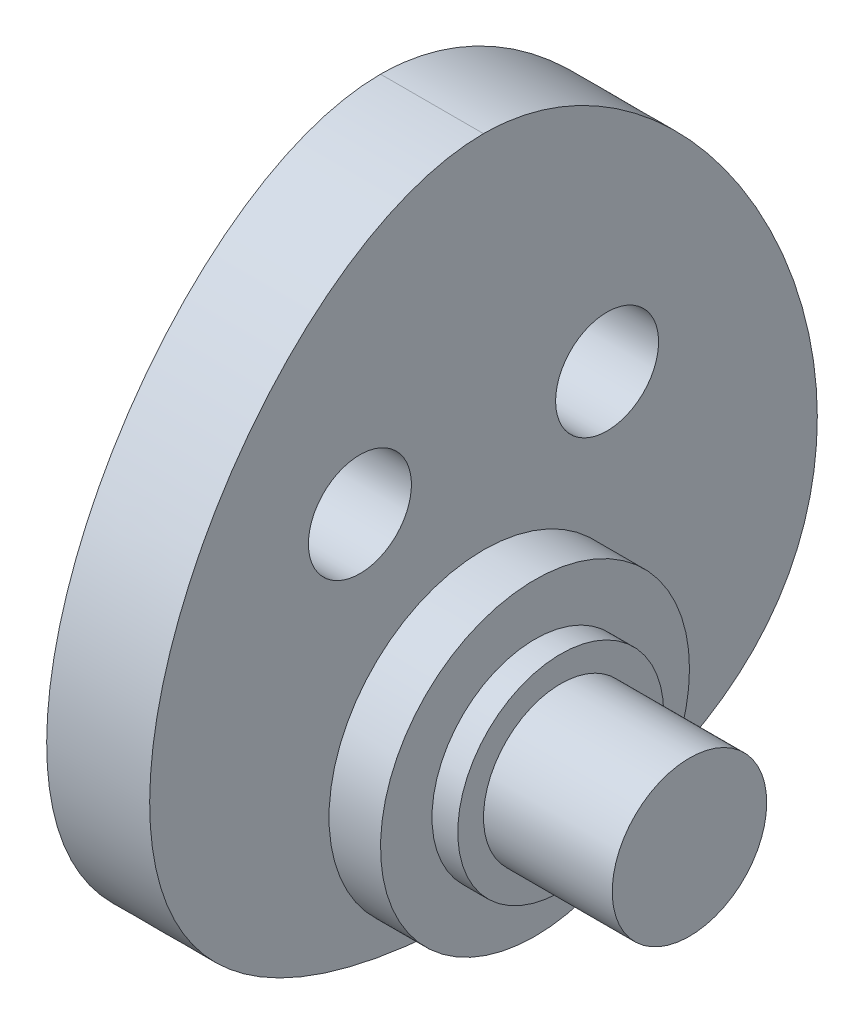
from build123d import *

# Parameters (mm, degrees)
SKETCH1_R           = 2.5
BOSS_EXTRUDE1_DEPTH = 2
SKETCH2_R           = 3
BOSS_EXTRUDE2_DEPTH = 4
CUT_EXTRUDE1_REACH  = 15.343
SKETCH3_R           = 1
CHAMFER1_SIZE       = 1
SKETCH4_OUTSIDE_W   = 18.83
SKETCH4_OUTSIDE_H   = 18.864
SKETCH4_OUTSIDE_R   = 1.5
CUT_EXTRUDE2_DEPTH  = 2.5
SKETCH5_OUTSIDE_W   = 18.83
SKETCH5_OUTSIDE_H   = 18.864
SKETCH5_OUTSIDE_R   = 2
CUT_EXTRUDE3_DEPTH  = 0.5


with BuildPart() as part:
    # Sketch1 → Boss-Extrude1 (new body)
    with BuildSketch(Plane(origin=(0, 0, 0), x_dir=(0, 0, -1), z_dir=(1, 0, 0))):
        with BuildLine():
            add(Edge.make_bspline(
                [(0, 10), (-5.575397586, 10), (-11.256765776, -3), (0, -3)],
                knots=[0, 0, 0, 0, 1, 1, 1, 1], degree=3))
            add(Edge.make_bspline(
                [(0, 10), (5.575397586, 10), (11.256765776, -3), (0, -3)],
                knots=[0, 0, 0, 0, 1, 1, 1, 1], degree=3))
        make_face()
        Circle(SKETCH1_R, mode=Mode.SUBTRACT)
    extrude(amount=BOSS_EXTRUDE1_DEPTH)

    # Sketch2 → Boss-Extrude2 (add)
    with BuildSketch(Plane(origin=(2, 0, 0), x_dir=(0, 0, -1), z_dir=(1, 0, 0))):
        with Locations(Location((0, 0, 0), (0, 0, 270))):
            Circle(SKETCH2_R)
    extrude(amount=BOSS_EXTRUDE2_DEPTH)

    # Sketch3 → Cut-Extrude1 (cut, up to next)
    with BuildSketch(Plane.ZY, mode=Mode.PRIVATE) as cut_extrude1_sk1:
        with Locations((-2.4, 4.8)):
            Circle(SKETCH3_R)
    cut_extrude1_tool1 = extrude(cut_extrude1_sk1.sketch, amount=-CUT_EXTRUDE1_REACH, mode=Mode.PRIVATE) & part.part
    # Sketch3 → Cut-Extrude1 (cut, up to next)
    with BuildSketch(Plane.ZY, mode=Mode.PRIVATE) as cut_extrude1_sk2:
        with Locations((2.4, 4.8)):
            Circle(SKETCH3_R)
    cut_extrude1_tool2 = extrude(cut_extrude1_sk2.sketch, amount=-CUT_EXTRUDE1_REACH, mode=Mode.PRIVATE) & part.part
    add(cut_extrude1_tool1.solids().sort_by_distance((0, 4.8, -2.4))[0], mode=Mode.SUBTRACT)
    add(cut_extrude1_tool2.solids().sort_by_distance((0, 4.8, 2.4))[0], mode=Mode.SUBTRACT)

    # Chamfer1
    chamfer1_edges = [part.edges().sort_by_distance(p)[0] for p in [
        (2, 0, 2.5),
    ]]
    chamfer(chamfer1_edges, length=CHAMFER1_SIZE)

    # Sketch4 outside → Cut-Extrude2 (cut)
    with BuildSketch(Plane(origin=(6, 0, 0), x_dir=(0, 0, -1), z_dir=(1, 0, 0))):
        with Locations((0, 3.5)):
            Rectangle(SKETCH4_OUTSIDE_W, SKETCH4_OUTSIDE_H)
        Circle(SKETCH4_OUTSIDE_R, mode=Mode.SUBTRACT)
    extrude(amount=-CUT_EXTRUDE2_DEPTH, mode=Mode.SUBTRACT)

    # Sketch5 outside → Cut-Extrude3 (cut)
    with BuildSketch(Plane(origin=(3.5, 0, 0), x_dir=(0, 0, -1), z_dir=(1, 0, 0))):
        with Locations((0, 3.5)):
            Rectangle(SKETCH5_OUTSIDE_W, SKETCH5_OUTSIDE_H)
        Circle(SKETCH5_OUTSIDE_R, mode=Mode.SUBTRACT)
    extrude(amount=-CUT_EXTRUDE3_DEPTH, mode=Mode.SUBTRACT)


solid = part.part
